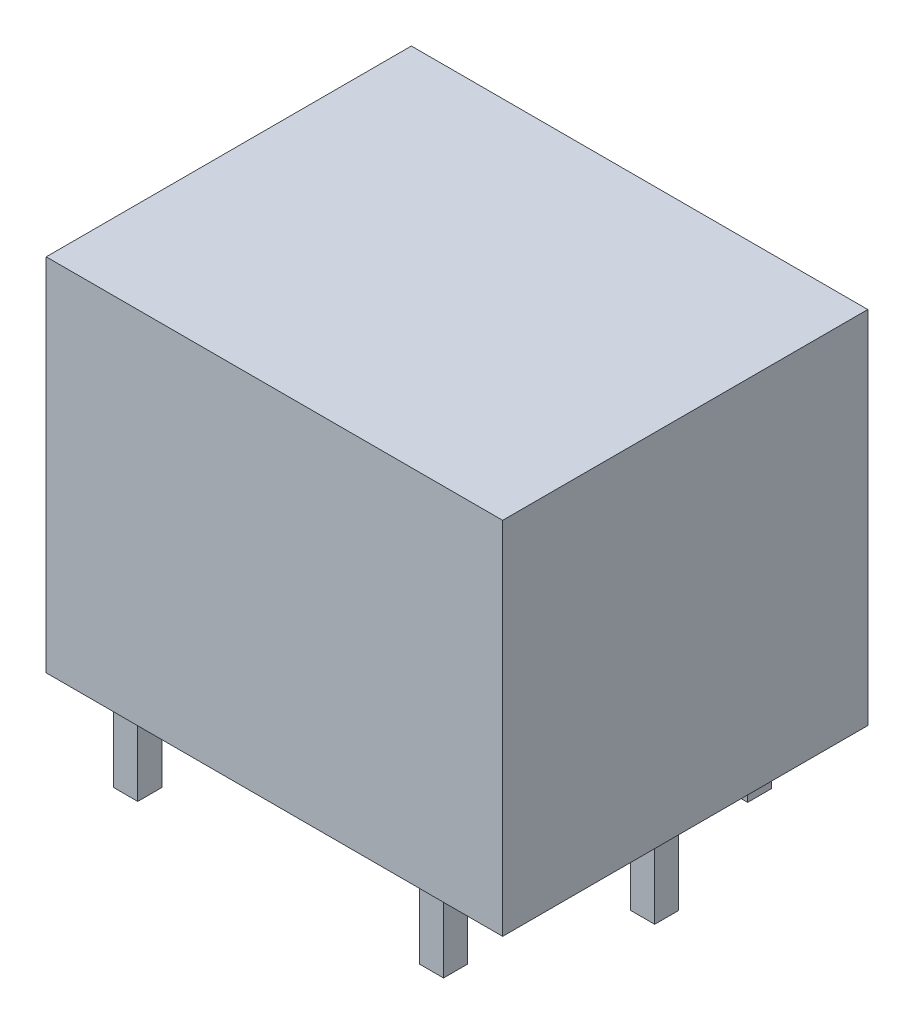
from build123d import *

# Parameters (mm, degrees)
SKETCH_1_W      = 19
SKETCH_1_H      = 15.2
EXTRUDE_1_DEPTH = 15
SKETCH_2_W      = 1
SKETCH_2_H      = 1
EXTRUDE_2_DEPTH = 3.5


with BuildPart() as part:
    # 草图1 → 拉伸1 (new body)
    with BuildSketch(Plane(origin=(0, 0, 0), x_dir=(1, 0, 0), z_dir=(0, 1, 0))):
        Rectangle(SKETCH_1_W, SKETCH_1_H)
    extrude(amount=EXTRUDE_1_DEPTH)

    # 草图2 → 拉伸2 (add)
    with BuildSketch(Plane.XZ):
        with Locations((8.23, 0)):
            Rectangle(SKETCH_2_W, SKETCH_2_H)
        with Locations((5.77, 6.33)):
            Rectangle(SKETCH_2_W, SKETCH_2_H)
        with Locations((-6.96, 6.33)):
            Rectangle(SKETCH_2_W, SKETCH_2_H)
        with Locations((-6.96, -6.33)):
            Rectangle(SKETCH_2_W, SKETCH_2_H)
        with Locations((5.77, -6.33)):
            Rectangle(SKETCH_2_W, SKETCH_2_H)
    extrude(amount=EXTRUDE_2_DEPTH)


solid = part.part
